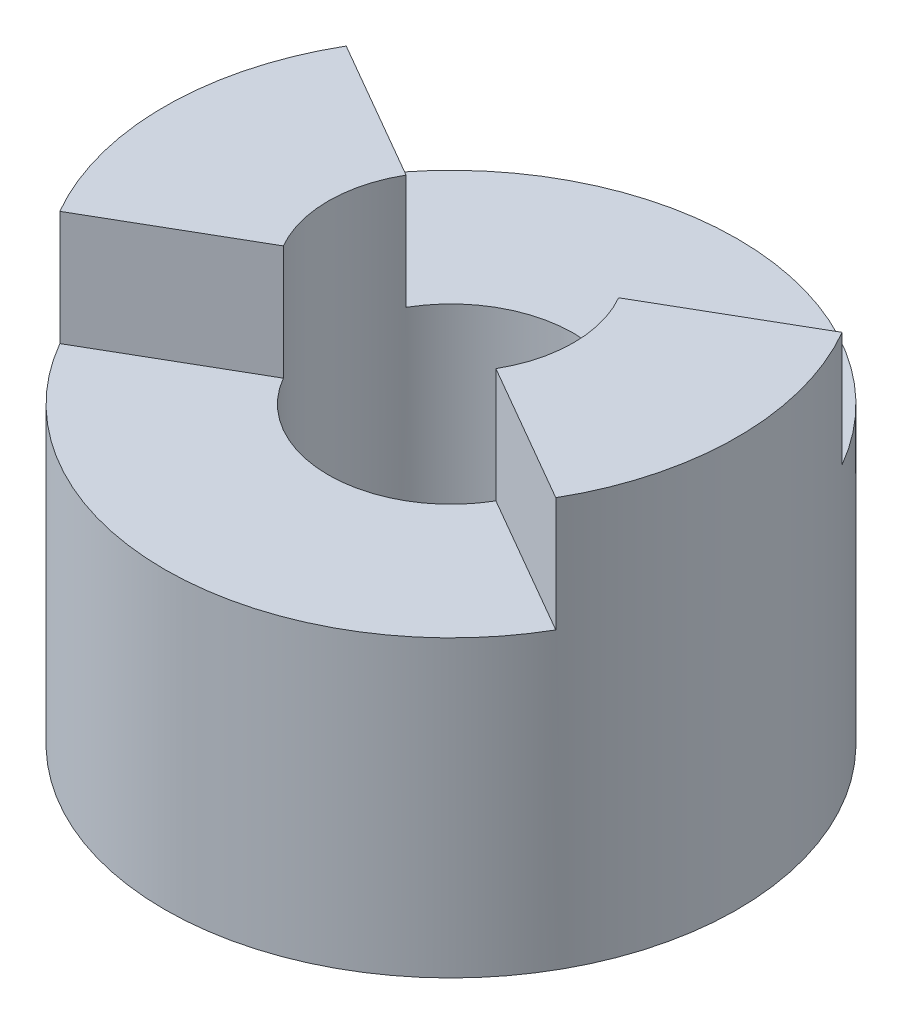
from build123d import *

# Parameters (mm, degrees)
SKETCH1_R           = 35
SKETCH1_R_2         = 15
BOSS_EXTRUDE1_DEPTH = 50
CUT_EXTRUDE1_START  = -14
CUT_EXTRUDE1_DEPTH  = 14


with BuildPart() as part:
    # Sketch1 → Boss-Extrude1 (new body)
    with BuildSketch(Plane(origin=(0, 0, 0), x_dir=(1, 0, 0), z_dir=(0, 1, 0))):
        with Locations(Location((0, 0, 0), (0, 0, 270))):
            Circle(SKETCH1_R)
        with Locations(Location((0, 0, 0), (0, 0, 270))):
            Circle(SKETCH1_R_2, mode=Mode.SUBTRACT)
    extrude(amount=BOSS_EXTRUDE1_DEPTH)

    # Sketch2 → Cut-Extrude1 (cut)
    with BuildSketch(Plane(origin=(0, 50, 0), x_dir=(1, 0, 0), z_dir=(0, 1, 0)).offset(CUT_EXTRUDE1_START)):
        with BuildLine():
            Line((12.990381057, -7.5), (30.310889132, -17.5))
            ThreePointArc((30.310889132, -17.5), (0, -35), (-30.310889132, -17.5))
            Line((-30.310889132, -17.5), (-12.990381057, -7.5))
            ThreePointArc((-12.990381057, -7.5), (0, -15), (12.990381057, -7.5))
        make_face()
    cut_extrude1 = extrude(amount=CUT_EXTRUDE1_DEPTH, mode=Mode.SUBTRACT)

    # Mirror1: Cut-Extrude1 across plane
    add(cut_extrude1.mirror(Plane.XY), mode=Mode.SUBTRACT)


solid = part.part
